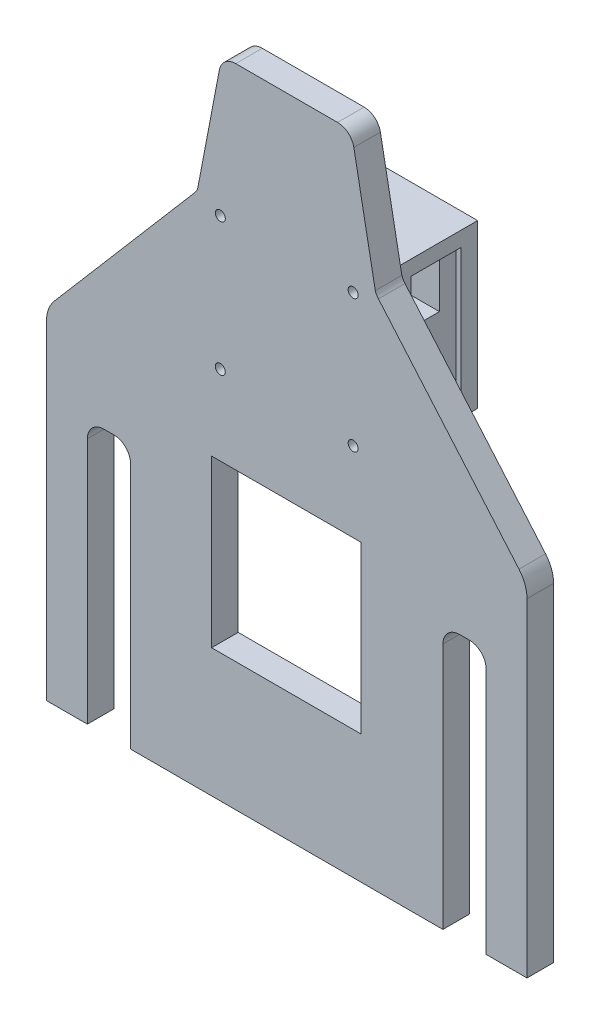
from build123d import *

# Parameters (mm, degrees)
BOSS_EXTRUDE1_DEPTH    = 8
SKETCH2_W              = 45
SKETCH2_H              = 50
CUT_EXTRUDE1_DEPTH     = 342.206659287
SPLIT1_SURFACE_1_BACK  = 343.199
SPLIT1_SURFACE_1_DEPTH = 686.398
SPLIT1_SURFACE_2_BACK  = 343.199
SPLIT1_SURFACE_2_DEPTH = 686.398
SKETCH5_R              = 2.5
CUT_EXTRUDE6_DEPTH     = 5.2
SKETCH4_R              = 2.5
CUT_EXTRUDE7_DEPTH     = 5.2
SKETCH6_R              = 1.5
CUT_EXTRUDE8_DEPTH     = 342.206659287
SKETCH7_W              = 49
SKETCH7_H              = 49
SKETCH7_W_2            = 18
SKETCH7_H_2            = 18
BOSS_EXTRUDE2_DEPTH    = 15
SKETCH8_W              = 49
SKETCH8_H              = 49
SKETCH8_R              = 1.5
BOSS_EXTRUDE3_DEPTH    = 10
SKETCH9_W              = 15
SKETCH9_H              = 40
CUT_EXTRUDE9_DEPTH     = 1.5
SKETCH11_W             = 15
SKETCH11_H             = 40
CUT_EXTRUDE10_DEPTH    = 1.5


with BuildPart() as part:
    # Sketch1 → Boss-Extrude1 (new body)
    with BuildSketch(Plane.XY):
        with BuildLine():
            Line((70, 309.985818768), (85.299227191, 309.985818768))
            ThreePointArc((85.299227191, 309.985818768), (88.489017574, 308.836174247), (90.211957942, 305.915913694))
            Line((90.211957942, 305.915913694), (96.672728921, 271.790334282))
            ThreePointArc((96.672728921, 271.790334282), (97.06575438, 270.906904614), (97.621470019, 270.115641625))
            Line((97.621470019, 270.115641625), (139.950460317, 220.786053348))
            ThreePointArc((139.950460317, 220.786053348), (141.739336996, 217.746026552), (142.361429131, 214.274017901))
            Line((142.361429131, 214.274017901), (142.361429131, 30.859943174))
            ThreePointArc((142.361429131, 30.859943174), (140.896963037, 27.324409268), (137.361429131, 25.859943174))
            Line((137.361429131, 25.859943174), (114.717190871, 25.782318449))
            ThreePointArc((114.717190871, 25.782318449), (112.681998989, 25.341726514), (111.002773989, 24.110332733))
            Line((111.002773989, 24.110332733), (89.38285929, 0))
            Line((89.38285929, 0), (50.5, 0))
            Line((50.5, 0), (28.997226011, 24.110332733))
            ThreePointArc((28.997226011, 24.110332733), (27.318001011, 25.341726514), (25.282809129, 25.782318449))
            Line((25.282809129, 25.782318449), (2.638570869, 25.859943174))
            ThreePointArc((2.638570869, 25.859943174), (-0.896963037, 27.324409268), (-2.361429131, 30.859943174))
            Line((-2.361429131, 30.859943174), (-2.361429131, 214.274017901))
            ThreePointArc((-2.361429131, 214.274017901), (-1.739336996, 217.746026552), (0.049539683, 220.786053348))
            Line((0.049539683, 220.786053348), (42.261389271, 270.115641625))
            ThreePointArc((42.261389271, 270.115641625), (42.81710491, 270.906904614), (43.210130369, 271.790334282))
            Line((43.210130369, 271.790334282), (49.724618218, 305.923183314))
            ThreePointArc((49.724618218, 305.923183314), (51.449026762, 308.838533573), (54.635967087, 309.985818768))
            Line((54.635967087, 309.985818768), (70, 309.985818768))
        make_face()
        with BuildLine():
            Line((15.218798766, 54.807228462), (17.702103505, 54.807228462))
            ThreePointArc((17.702103505, 54.807228462), (21.420312934, 56.347361236), (22.960445707, 60.065570665))
            Line((22.960445707, 60.065570665), (22.960445707, 189.807228462))
            ThreePointArc((22.960445707, 189.807228462), (21.495979613, 193.342762368), (17.960445707, 194.807228462))
            Line((17.960445707, 194.807228462), (14.960456564, 194.807228462))
            ThreePointArc((14.960456564, 194.807228462), (11.424922658, 193.342762368), (9.960456564, 189.807228462))
            Line((9.960456564, 189.807228462), (9.960456564, 60.065570665))
            ThreePointArc((9.960456564, 60.065570665), (11.500589337, 56.347361236), (15.218798766, 54.807228462))
        make_face(mode=Mode.SUBTRACT)
        with BuildLine():
            Line((125.039543436, 54.807228462), (122.039554293, 54.807228462))
            ThreePointArc((122.039554293, 54.807228462), (118.504020387, 56.271694556), (117.039554293, 59.807228462))
            Line((117.039554293, 59.807228462), (117.039554293, 189.807228462))
            ThreePointArc((117.039554293, 189.807228462), (118.504020387, 193.342762368), (122.039554293, 194.807228462))
            Line((122.039554293, 194.807228462), (125.039543436, 194.807228462))
            ThreePointArc((125.039543436, 194.807228462), (128.575077342, 193.342762368), (130.039543436, 189.807228462))
            Line((130.039543436, 189.807228462), (130.039543436, 59.807228462))
            ThreePointArc((130.039543436, 59.807228462), (128.575077342, 56.271694556), (125.039543436, 54.807228462))
        make_face(mode=Mode.SUBTRACT)
    extrude(amount=BOSS_EXTRUDE1_DEPTH)

    # Sketch2 → Cut-Extrude1 (cut, through all)
    with BuildSketch(Plane.XY.offset(8)):
        with Locations((69.88285929, 179.008918923)):
            Rectangle(SKETCH2_W, SKETCH2_H)
    extrude(amount=-CUT_EXTRUDE1_DEPTH, mode=Mode.SUBTRACT)


with BuildPart() as body_2:
    # Split1: the piece behind the surface
    add(part.part)
    # Split1 surface: a surface, the sketch's curves swept straight by 686.398 mm
    with BuildLine(Plane(origin=(0, 0, 0), x_dir=(-1, 0, 0), z_dir=(0, 0, -1)).offset(-SPLIT1_SURFACE_1_BACK), mode=Mode.PRIVATE) as split1_surface_1_path:
        Line((-142.361429131, 115.359943174), (2.361429131, 115.359943174))
    split1_surface_1 = Shell.extrude(split1_surface_1_path.wire(), (0 * SPLIT1_SURFACE_1_DEPTH, 0 * SPLIT1_SURFACE_1_DEPTH, -1 * SPLIT1_SURFACE_1_DEPTH))
    split(bisect_by=split1_surface_1, keep=Keep.BOTTOM)

    # Sketch5 → Cut-Extrude6 (cut)
    with BuildSketch(Plane(origin=(0, 115.359943174, -115.359943174), x_dir=(1, 0, 0), z_dir=(0, -1, 0))):
        with Locations(Location((70, 119.359943174, 0), (0, 0, 270))):
            Circle(SKETCH5_R)
        with Locations(Location((40, 119.359943174, 0), (0, 0, 270))):
            Circle(SKETCH5_R)
        with Locations(Location((2.638570869, 119.359943174, 0), (0, 0, 270))):
            Circle(SKETCH5_R)
    extrude(amount=CUT_EXTRUDE6_DEPTH, mode=Mode.SUBTRACT)


with BuildPart() as part_1:
    add(part.part)

    # Split1: split by a surface, the side it looks to stays
    # Split1 surface: a surface, the sketch's curves swept straight by 686.398 mm
    with BuildLine(Plane(origin=(0, 0, 0), x_dir=(-1, 0, 0), z_dir=(0, 0, -1)).offset(-SPLIT1_SURFACE_2_BACK), mode=Mode.PRIVATE) as split1_surface_2_path:
        Line((-142.361429131, 115.359943174), (2.361429131, 115.359943174))
    split1_surface_2 = Shell.extrude(split1_surface_2_path.wire(), (0 * SPLIT1_SURFACE_2_DEPTH, 0 * SPLIT1_SURFACE_2_DEPTH, -1 * SPLIT1_SURFACE_2_DEPTH))
    split(bisect_by=split1_surface_2, keep=Keep.TOP)

    # Sketch4 → Cut-Extrude7 (cut)
    with BuildSketch(Plane(origin=(0, 115.359943174, 0), x_dir=(-1, 0, 0), z_dir=(0, -1, 0))):
        with Locations(Location((-70, -4, 0), (0, 0, 270))):
            Circle(SKETCH4_R)
        with Locations(Location((-40, -4, 0), (0, 0, 270))):
            Circle(SKETCH4_R)
        with Locations(Location((-100, -4, 0), (0, 0, 270))):
            Circle(SKETCH4_R)
        with Locations(Location((-137.361429131, -4, 0), (0, 0, 90))):
            Circle(SKETCH4_R)
        with Locations(Location((-3.799513716, -4, 0), (0, 0, 270))):
            Circle(SKETCH4_R)
    extrude(amount=-CUT_EXTRUDE7_DEPTH, mode=Mode.SUBTRACT)

    # Sketch6 → Cut-Extrude8 (cut, through all)
    with BuildSketch(Plane.XY.offset(8)):
        with Locations((50.000130369, 267.980334282)):
            Circle(SKETCH6_R)
        with Locations((90.000130369, 267.980334282)):
            Circle(SKETCH6_R)
        with Locations((90.000130369, 227.980334282)):
            Circle(SKETCH6_R)
        with Locations((50.000130369, 227.980334282)):
            Circle(SKETCH6_R)
    extrude(amount=-CUT_EXTRUDE8_DEPTH, mode=Mode.SUBTRACT)

    # Sketch7 → Boss-Extrude2 (add)
    with BuildSketch(Plane(origin=(0, 0, 0), x_dir=(-1, 0, 0), z_dir=(0, 0, -1))):
        with Locations((-70.000130369, 247.980334282)):
            Rectangle(SKETCH7_W, SKETCH7_H)
        with Locations((-56.000130369, 261.980334282)):
            Rectangle(SKETCH7_W_2, SKETCH7_H_2, mode=Mode.SUBTRACT)
        with Locations((-84.000130369, 261.980334282)):
            Rectangle(SKETCH7_W_2, SKETCH7_H_2, mode=Mode.SUBTRACT)
        with Locations((-84.000130369, 233.980334282)):
            Rectangle(SKETCH7_W_2, SKETCH7_H_2, mode=Mode.SUBTRACT)
        with Locations((-56.000130369, 233.980334282)):
            Rectangle(SKETCH7_W_2, SKETCH7_H_2, mode=Mode.SUBTRACT)
    extrude(amount=BOSS_EXTRUDE2_DEPTH)

    # Sketch8 → Boss-Extrude3 (add)
    with BuildSketch(Plane(origin=(0, 0, -15), x_dir=(-1, 0, 0), z_dir=(0, 0, -1))):
        with Locations((-70.000130369, 247.980334282)):
            Rectangle(SKETCH8_W, SKETCH8_H)
        with Locations(Location((-50.000130369, 267.980334282, 0), (0, 0, 180))):
            Circle(SKETCH8_R, mode=Mode.SUBTRACT)
        with Locations(Location((-90.000130369, 267.980334282, 0), (0, 0, 180))):
            Circle(SKETCH8_R, mode=Mode.SUBTRACT)
        with Locations(Location((-50.000130369, 227.980334282, 0), (0, 0, 180))):
            Circle(SKETCH8_R, mode=Mode.SUBTRACT)
        with Locations(Location((-90.000130369, 227.980334282, 0), (0, 0, 180))):
            Circle(SKETCH8_R, mode=Mode.SUBTRACT)
    extrude(amount=BOSS_EXTRUDE3_DEPTH)

    # Sketch9 → Cut-Extrude9 (cut)
    with BuildSketch(Plane.ZY.offset(-45.500130369)):
        with Locations((-12.5, 247.980334282)):
            Rectangle(SKETCH9_W, SKETCH9_H)
    extrude(amount=-CUT_EXTRUDE9_DEPTH, mode=Mode.SUBTRACT)

    # Sketch11 → Cut-Extrude10 (cut)
    with BuildSketch(Plane(origin=(94.500130369, 0, 0), x_dir=(0, 0, -1), z_dir=(1, 0, 0))):
        with Locations((12.5, 247.980334282)):
            Rectangle(SKETCH11_W, SKETCH11_H)
    extrude(amount=-CUT_EXTRUDE10_DEPTH, mode=Mode.SUBTRACT)


solid = part_1.part
